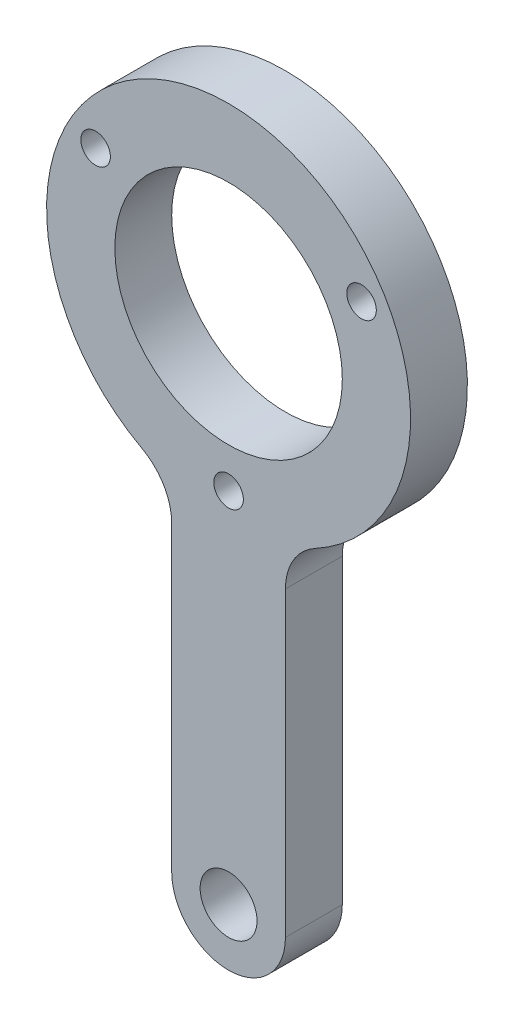
from build123d import *

# Parameters (mm, degrees)
EXTRUDE_1_DEPTH     = 5
SKETCH_3_R          = 2.5
CUT_EXTRUDE_1_DEPTH = 24
SKETCH_4_R          = 1.525
CUT_EXTRUDE_2_DEPTH = 5
SKETCH_5_R          = 2.5
CUT_EXTRUDE_3_DEPTH = 5
FILLET_1_R          = 5
SKETCH_6_R          = 1.3
SKETCH_6_R_2        = 10
CUT_EXTRUDE_4_DEPTH = 10
SKETCH_7_R          = 16
SKETCH_7_R_2        = 10
SKETCH_7_R_3        = 1.3
EXTRUDE_2_DEPTH     = 5
FILLET_2_R          = 5


with BuildPart() as part:
    # 草图1 → 凸台-拉伸1 (new body)
    with BuildSketch(Plane.XY):
        with BuildLine():
            Line((5, -8.077747211), (5, -45))
            ThreePointArc((5, -45), (0, -50), (-5, -45))
            Line((-5, -45), (-5, -8.077747211))
            ThreePointArc((-5, -8.077747211), (0, 9.5), (5, -8.077747211))
        make_face()
    extrude(amount=EXTRUDE_1_DEPTH)

    # 草图3 → 切除-拉伸1 (cut)
    with BuildSketch(Plane.XY.offset(5)):
        with Locations((0, -45)):
            Circle(SKETCH_3_R)
    extrude(amount=-CUT_EXTRUDE_1_DEPTH, mode=Mode.SUBTRACT)

    # 草图4 → 切除-拉伸2 (cut)
    with BuildSketch(Plane.XY.offset(5)):
        with Locations((0, 6.25)):
            Circle(SKETCH_4_R)
        with Locations((0, -6.25)):
            Circle(SKETCH_4_R)
    extrude(amount=-CUT_EXTRUDE_2_DEPTH, mode=Mode.SUBTRACT)

    # 草图5 → 切除-拉伸3 (cut)
    with BuildSketch(Plane.XY.offset(5)):
        Circle(SKETCH_5_R)
    extrude(amount=-CUT_EXTRUDE_3_DEPTH, mode=Mode.SUBTRACT)

    # 圆角1
    fillet_1_edges = [part.edges().sort_by_distance(p)[0] for p in [
        (-5, -8.077747211, 2.5),
        (5, -8.077747211, 2.5),
    ]]
    fillet(fillet_1_edges, radius=FILLET_1_R)

    # 草图6 → 切除-拉伸4 (cut)
    with BuildSketch(Plane.XY.offset(5)):
        with Locations((0, -13.5)):
            Circle(SKETCH_6_R)
        Circle(SKETCH_6_R_2)
    extrude(amount=-CUT_EXTRUDE_4_DEPTH, mode=Mode.SUBTRACT)

    # 草图7 → 凸台-拉伸2 (add)
    with BuildSketch(Plane.XY.offset(5)):
        Circle(SKETCH_7_R)
        Circle(SKETCH_7_R_2, mode=Mode.SUBTRACT)
        with Locations((11.691342951, 6.75)):
            Circle(SKETCH_7_R_3, mode=Mode.SUBTRACT)
        with Locations((-11.691342951, 6.75)):
            Circle(SKETCH_7_R_3, mode=Mode.SUBTRACT)
        with Locations((0, -13.5)):
            Circle(SKETCH_7_R_3, mode=Mode.SUBTRACT)
    extrude(amount=-EXTRUDE_2_DEPTH)

    # 圆角2
    fillet_2_edges = [part.edges().sort_by_distance(p)[0] for p in [
        (5, -15.198684154, 2.5),
        (-5, -15.198684154, 2.5),
    ]]
    fillet(fillet_2_edges, radius=FILLET_2_R)


solid = part.part
